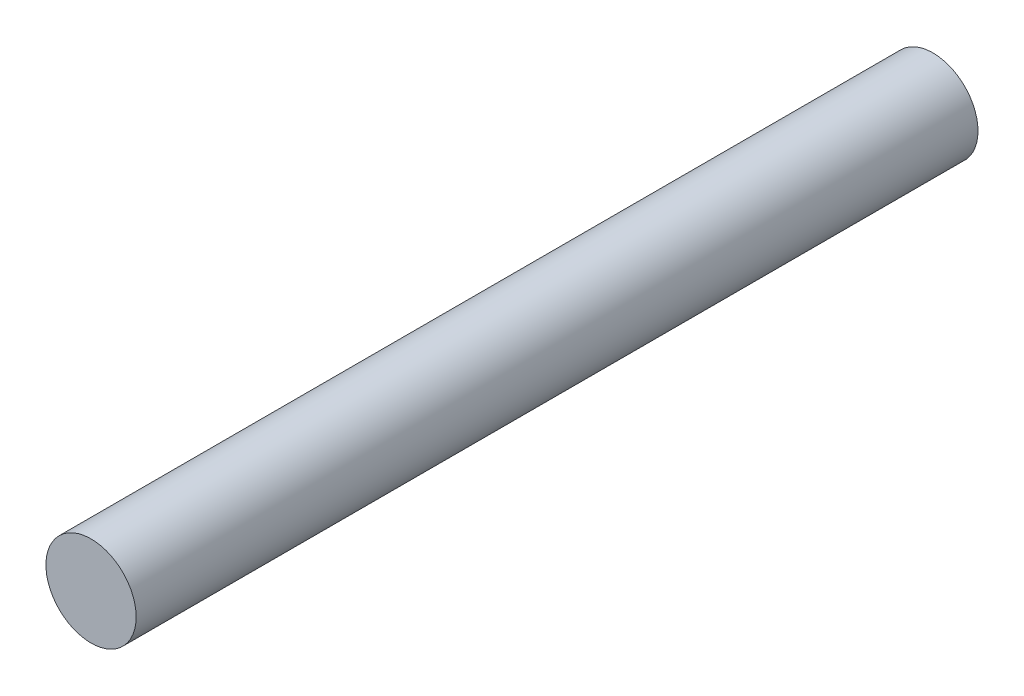
from build123d import *

# Parameters (mm, degrees)
SKETCH1_R           = 10.7200241
BOSS_EXTRUDE1_DEPTH = 200


with BuildPart() as part:
    # Sketch1 → Boss-Extrude1 (new body)
    with BuildSketch(Plane.XY):
        Circle(SKETCH1_R)
    extrude(amount=BOSS_EXTRUDE1_DEPTH)


solid = part.part
